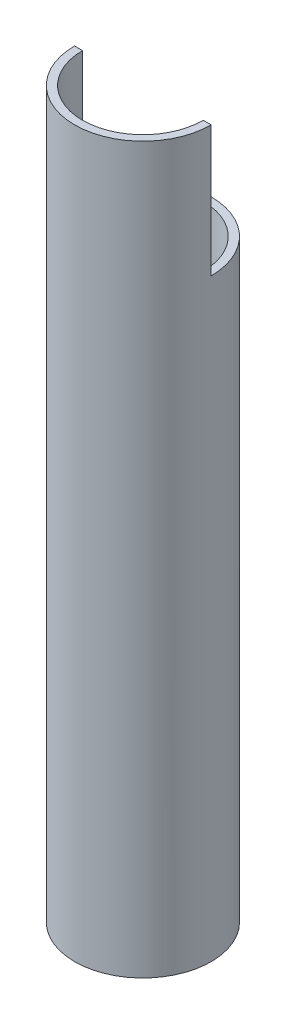
from build123d import *

# Parameters (mm, degrees)
SKETCH1_R           = 14.375
SKETCH1_R_2         = 12.7
BOSS_EXTRUDE1_DEPTH = 152.5
SKETCH2_W           = 29.71625972
SKETCH2_H           = 15.555523124
CUT_EXTRUDE1_DEPTH  = 27.5


with BuildPart() as part:
    # Sketch1 → Boss-Extrude1 (new body)
    with BuildSketch(Plane(origin=(0, 0, 0), x_dir=(1, 0, 0), z_dir=(0, 1, 0))):
        with Locations(Location((0, 0, 0), (0, 0, 270))):
            Circle(SKETCH1_R)
        with Locations(Location((0, 0, 0), (0, 0, 270))):
            Circle(SKETCH1_R_2, mode=Mode.SUBTRACT)
    extrude(amount=BOSS_EXTRUDE1_DEPTH)

    # Sketch2 → Cut-Extrude1 (cut)
    with BuildSketch(Plane(origin=(0, 152.5, 0), x_dir=(1, 0, 0), z_dir=(0, 1, 0))):
        with Locations((0.48312986, 7.777761562)):
            Rectangle(SKETCH2_W, SKETCH2_H)
    extrude(amount=-CUT_EXTRUDE1_DEPTH, mode=Mode.SUBTRACT)


solid = part.part
